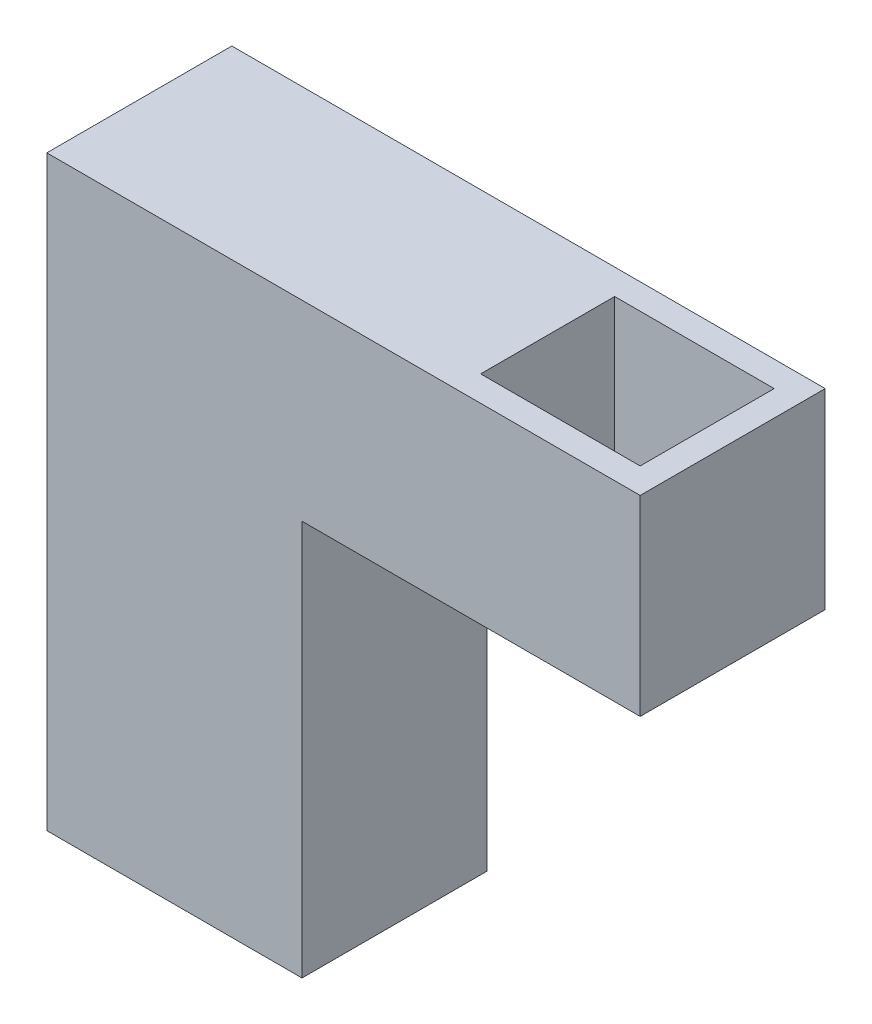
from build123d import *

# Parameters (mm, degrees)
SKETCH1_W           = 16.5
SKETCH1_H           = 14.5
SKETCH1_W_2         = 12.5
SKETCH1_H_2         = 10.5
BOSS_EXTRUDE1_DEPTH = 15
SKETCH2_W           = 14.5
SKETCH2_H           = 15
BOSS_EXTRUDE2_DEPTH = 30
SKETCH3_W           = 20
SKETCH3_H           = 14.5
BOSS_EXTRUDE3_DEPTH = 31


with BuildPart() as part:
    # Sketch1 → Boss-Extrude1 (new body)
    with BuildSketch(Plane(origin=(0, 0, 0), x_dir=(1, 0, 0), z_dir=(0, 1, 0))):
        with Locations((6.25, -5.25)):
            Rectangle(SKETCH1_W, SKETCH1_H)
        with Locations((6.25, -5.25)):
            Rectangle(SKETCH1_W_2, SKETCH1_H_2, mode=Mode.SUBTRACT)
    extrude(amount=BOSS_EXTRUDE1_DEPTH)

    # Sketch2 → Boss-Extrude2 (add)
    with BuildSketch(Plane.ZY.offset(2)):
        with Locations((5.25, 7.5)):
            Rectangle(SKETCH2_W, SKETCH2_H)
    extrude(amount=BOSS_EXTRUDE2_DEPTH)

    # Sketch3 → Boss-Extrude3 (add)
    with BuildSketch(Plane(origin=(0, 0, 0), x_dir=(-1, 0, 0), z_dir=(0, -1, 0))):
        with Locations((22, -5.25)):
            Rectangle(SKETCH3_W, SKETCH3_H)
    extrude(amount=BOSS_EXTRUDE3_DEPTH)


solid = part.part
